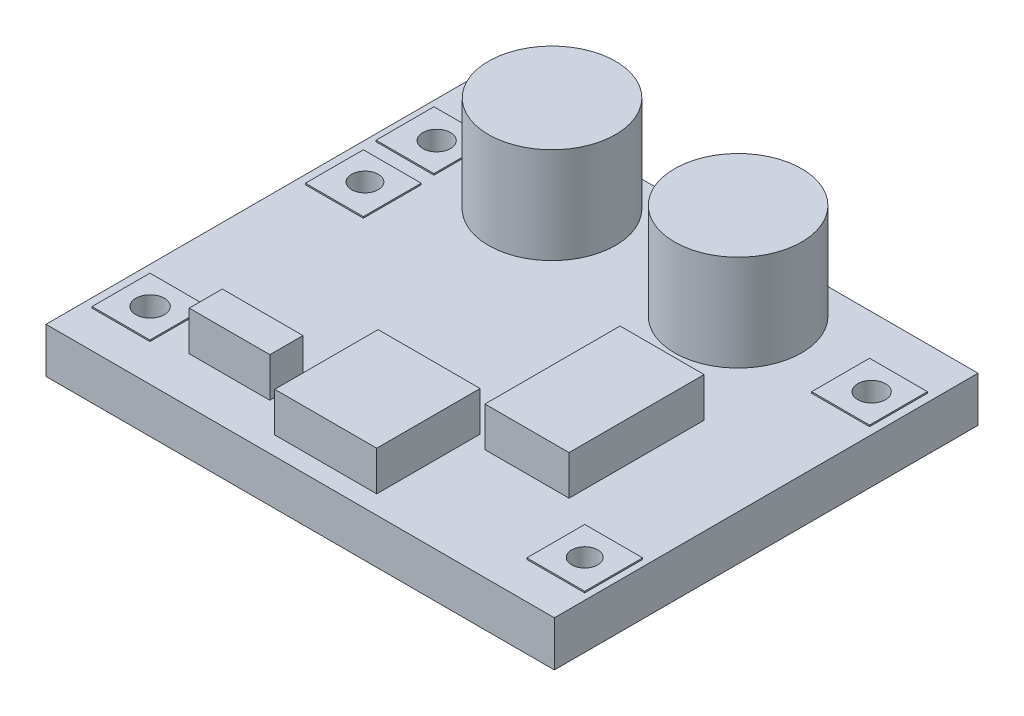
from build123d import *

# Parameters (mm, degrees)
SKETCH1_W                = 18
SKETCH1_H                = 15
SKETCH1_W_2              = 2.049458383
SKETCH1_H_2              = 2.049458384
SKETCH1_W_3              = 2.855539704
SKETCH1_H_3              = 1.171503468
SKETCH1_W_4              = 3.612135694
SKETCH1_H_4              = 3.660948338
SKETCH1_H_5              = 2.049458383
SKETCH1_W_5              = 2.977571315
SKETCH1_H_6              = 4.783639162
SKETCH1_W_6              = 2.049458384
SKETCH1_R                = 2.25
BOSS_EXTRUDE1_DEPTH      = 1.6
BOSS_EXTRUDE2_DEPTH      = 1.65
BOSS_EXTRUDE2_DEPTH_BACK = 0.05
SKETCH1_3_W              = 2.049458383
SKETCH1_3_H              = 2.049458383
SKETCH1_3_R              = 0.491297767
SKETCH1_3_W_2            = 2.049458384
SKETCH1_3_R_2            = 0.472938465
SKETCH1_3_H_2            = 2.049458384
SKETCH1_3_R_3            = 0.506268972
SKETCH1_3_R_4            = 0.49179988
SKETCH1_3_R_5            = 0.462232329
SKETCH1_4_R              = 2.25
BOSS_EXTRUDE3_DEPTH      = 5
SKETCH1_5_W              = 2.977571315
SKETCH1_5_H              = 4.783639162
SKETCH1_5_W_2            = 3.612135694
SKETCH1_5_H_2            = 3.660948338
SKETCH1_5_W_3            = 2.855539704
SKETCH1_5_H_3            = 1.171503468
BOSS_EXTRUDE4_DEPTH      = 3


with BuildPart() as part:
    # Sketch1 → Boss-Extrude1 (new body)
    with BuildSketch(Plane(origin=(0, 0, 0), x_dir=(1, 0, 0), z_dir=(0, 1, 0))):
        with Locations((438.509935884, 78.243204781)):
            Rectangle(SKETCH1_W, SKETCH1_H)
        with Locations((430.855961247, 73.0772243)):
            Rectangle(SKETCH1_W_2, SKETCH1_H_2, mode=Mode.SUBTRACT)
        with Locations((434.377292894, 72.961183722)):
            Rectangle(SKETCH1_W_3, SKETCH1_H_3, mode=Mode.SUBTRACT)
        with Locations((438.758227739, 73.229653267)):
            Rectangle(SKETCH1_W_4, SKETCH1_H_4, mode=Mode.SUBTRACT)
        with Locations((446.259482022, 73.069490495)):
            Rectangle(SKETCH1_W_2, SKETCH1_H_5, mode=Mode.SUBTRACT)
        with Locations((442.614426656, 77.061445861)):
            Rectangle(SKETCH1_W_5, SKETCH1_H_6, mode=Mode.SUBTRACT)
        with Locations((430.850957935, 80.638087475)):
            Rectangle(SKETCH1_W_6, SKETCH1_H_5, mode=Mode.SUBTRACT)
        with Locations((430.782103127, 83.20757709)):
            Rectangle(SKETCH1_W_2, SKETCH1_H_5, mode=Mode.SUBTRACT)
        with Locations((434.926435145, 83.243204781)):
            Circle(SKETCH1_R, mode=Mode.SUBTRACT)
        with Locations((441.516142154, 83.243204781)):
            Circle(SKETCH1_R, mode=Mode.SUBTRACT)
        with Locations((446.205622618, 83.20757709)):
            Rectangle(SKETCH1_W_2, SKETCH1_H_5, mode=Mode.SUBTRACT)
    extrude(amount=BOSS_EXTRUDE1_DEPTH)

    # Sketch1<3> → Boss-Extrude2 (add, two sides: drawn at the far end of the back side and taken through both)
    # profile 1 of 5: a face of its own
    with BuildSketch(Plane(origin=(0, 0, 0), x_dir=(1, 0, 0), z_dir=(0, 1, 0)).offset(-BOSS_EXTRUDE2_DEPTH_BACK)):
        with Locations((430.782103127, 83.20757709)):
            Rectangle(SKETCH1_3_W, SKETCH1_3_H)
        with Locations((430.842964154, 83.243204781)):
            Circle(SKETCH1_3_R, mode=Mode.SUBTRACT)
    # profile 2 of 5: a face of its own
    with BuildSketch(Plane(origin=(0, 0, 0), x_dir=(1, 0, 0), z_dir=(0, 1, 0)).offset(-BOSS_EXTRUDE2_DEPTH_BACK)):
        with Locations((430.850957935, 80.638087475)):
            Rectangle(SKETCH1_3_W_2, SKETCH1_3_H)
        with Locations((430.842964154, 80.703204781)):
            Circle(SKETCH1_3_R_2, mode=Mode.SUBTRACT)
    # profile 3 of 5: a face of its own
    with BuildSketch(Plane(origin=(0, 0, 0), x_dir=(1, 0, 0), z_dir=(0, 1, 0)).offset(-BOSS_EXTRUDE2_DEPTH_BACK)):
        with Locations((430.855961247, 73.0772243)):
            Rectangle(SKETCH1_3_W, SKETCH1_3_H_2)
        with Locations((430.855961247, 73.083204781)):
            Circle(SKETCH1_3_R_3, mode=Mode.SUBTRACT)
    # profile 4 of 5: a face of its own
    with BuildSketch(Plane(origin=(0, 0, 0), x_dir=(1, 0, 0), z_dir=(0, 1, 0)).offset(-BOSS_EXTRUDE2_DEPTH_BACK)):
        with Locations((446.205622618, 83.20757709)):
            Rectangle(SKETCH1_3_W, SKETCH1_3_H)
        with Locations((446.243933423, 83.243204781)):
            Circle(SKETCH1_3_R_4, mode=Mode.SUBTRACT)
    # profile 5 of 5: a face of its own
    with BuildSketch(Plane(origin=(0, 0, 0), x_dir=(1, 0, 0), z_dir=(0, 1, 0)).offset(-BOSS_EXTRUDE2_DEPTH_BACK)):
        with Locations((446.259482022, 73.069490495)):
            Rectangle(SKETCH1_3_W, SKETCH1_3_H)
        with Locations((446.243933423, 73.083204781)):
            Circle(SKETCH1_3_R_5, mode=Mode.SUBTRACT)
    extrude(amount=BOSS_EXTRUDE2_DEPTH + BOSS_EXTRUDE2_DEPTH_BACK)

    # Sketch1<4> → Boss-Extrude3 (add)
    with BuildSketch(Plane(origin=(0, 0, 0), x_dir=(1, 0, 0), z_dir=(0, 1, 0))):
        with Locations((434.926435145, 83.243204781)):
            Circle(SKETCH1_4_R)
        with Locations((441.516142154, 83.243204781)):
            Circle(SKETCH1_4_R)
    extrude(amount=BOSS_EXTRUDE3_DEPTH)

    # Sketch1<5> → Boss-Extrude4 (add)
    with BuildSketch(Plane(origin=(0, 0, 0), x_dir=(1, 0, 0), z_dir=(0, 1, 0))):
        with Locations((442.614426656, 77.061445861)):
            Rectangle(SKETCH1_5_W, SKETCH1_5_H)
        with Locations((438.758227739, 73.229653267)):
            Rectangle(SKETCH1_5_W_2, SKETCH1_5_H_2)
        with Locations((434.377292894, 72.961183722)):
            Rectangle(SKETCH1_5_W_3, SKETCH1_5_H_3)
    extrude(amount=BOSS_EXTRUDE4_DEPTH)


solid = part.part
